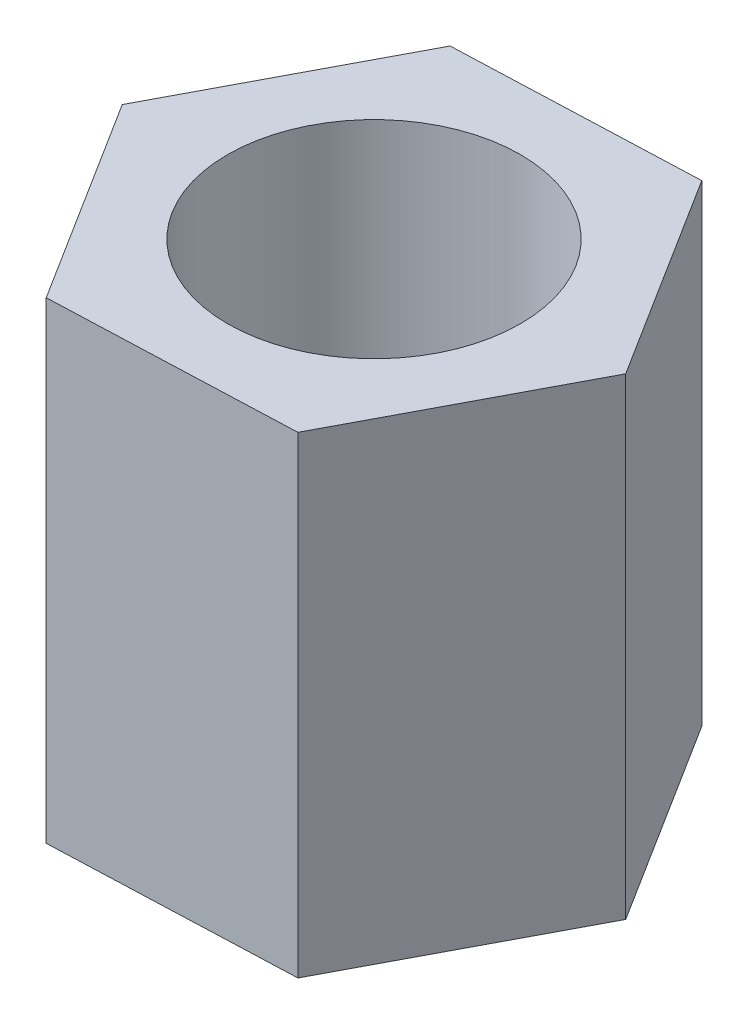
from build123d import *

# Parameters (mm, degrees)
SKETCH2_R           = 1.55
BOSS_EXTRUDE1_DEPTH = 5


with BuildPart() as part:
    # Sketch2 → Boss-Extrude1 (new body)
    with BuildSketch(Plane(origin=(0, 0, 0), x_dir=(1, 0, 0), z_dir=(0, 1, 0))):
        Polygon((2.565269859, 0.098132937), (1.197649313, 2.270655334), (-1.367620546, 2.172522397), (-2.565269859, -0.098132937), (-1.197649313, -2.270655334), (1.367620546, -2.172522397), align=None)
        with Locations(Location((0, 0, 0), (0, 0, 270))):
            Circle(SKETCH2_R, mode=Mode.SUBTRACT)
    extrude(amount=BOSS_EXTRUDE1_DEPTH)


solid = part.part
